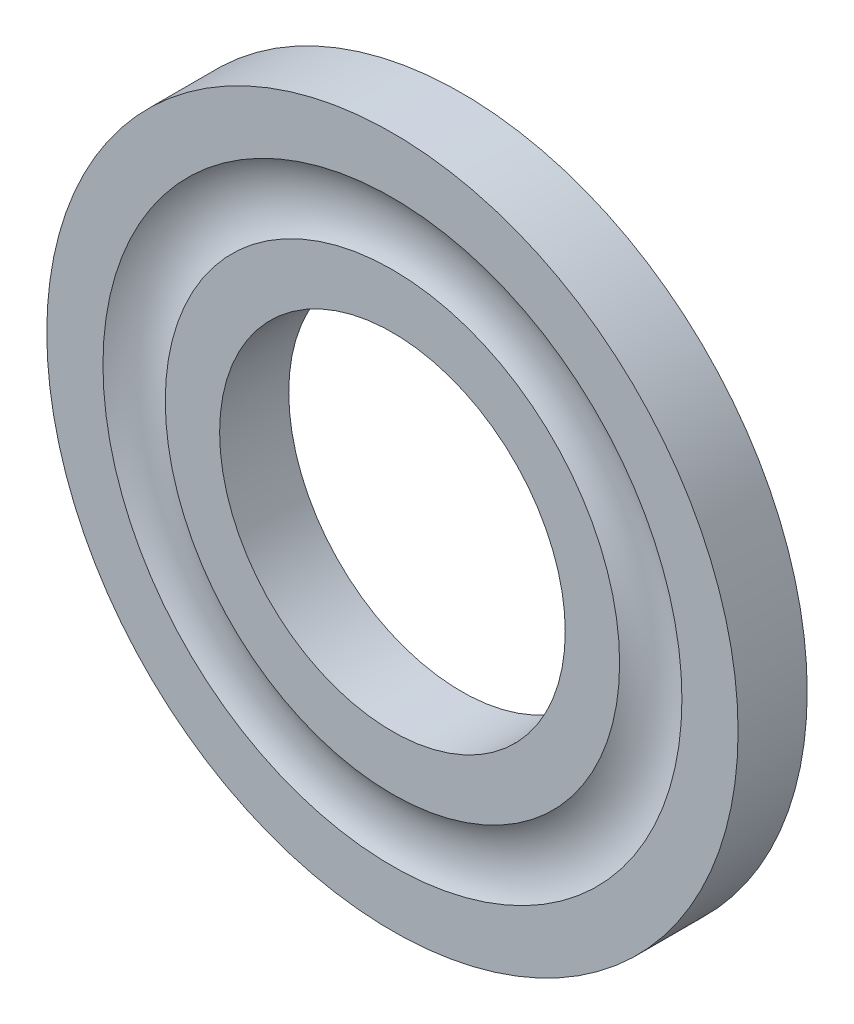
from build123d import *

# Parameters (mm, degrees)
SKETCH_1_R      = 20
SKETCH_1_R_2    = 10
EXTRUDE_1_DEPTH = 4
SKETCH_3_R      = 3.5


with BuildPart() as part:
    # Эскиз1 → Вытянуть1 (new body)
    with BuildSketch(Plane.XY):
        Circle(SKETCH_1_R)
        Circle(SKETCH_1_R_2, mode=Mode.SUBTRACT)
    extrude(amount=EXTRUDE_1_DEPTH)

    # Вырез-По траектории1: sweep along a path in Эскиз2
    with BuildLine(Plane.XY.offset(4)) as sweep_1_path:
        CenterArc((0, 0), 15, 0, 360)
    # Эскиз3 → Вырез-По траектории1 (sweep, cut)
    with BuildSketch(Plane(origin=(0, 0, 0), x_dir=(1, 0, 0), z_dir=(0, 1, 0))):
        with Locations((14.947787098, -7)):
            Circle(SKETCH_3_R)
    sweep(path=sweep_1_path.line, mode=Mode.SUBTRACT)


solid = part.part
